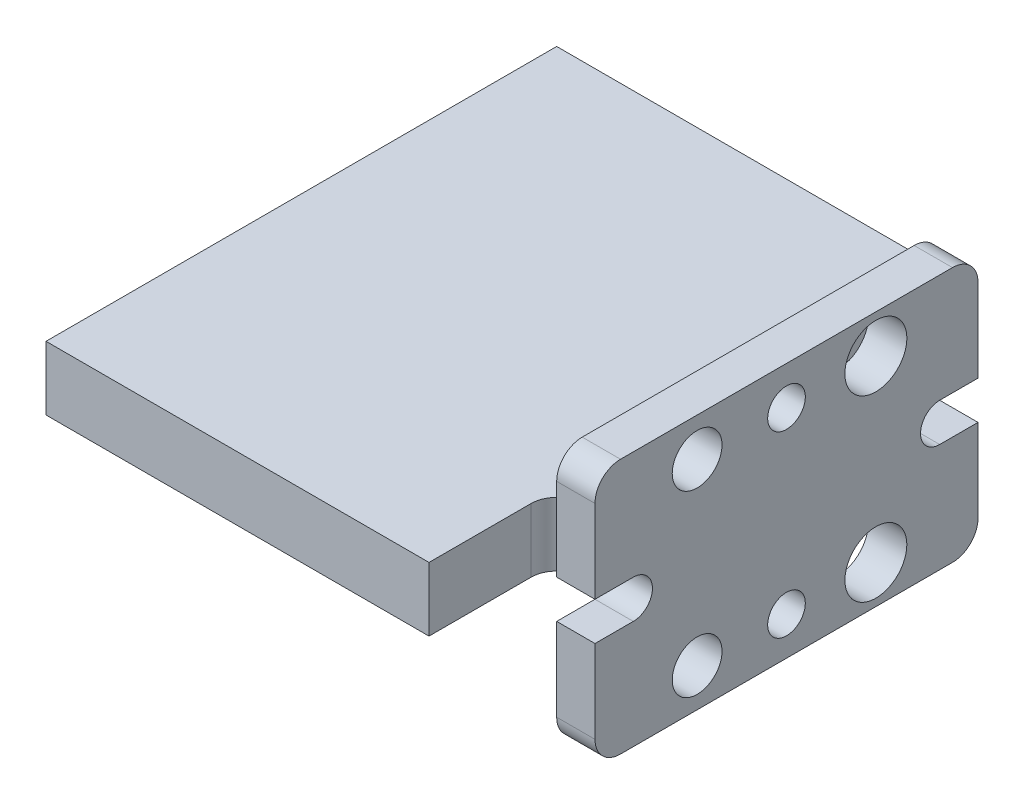
from build123d import *

# Parameters (mm, degrees)
SKETCH_1_W          = 20
SKETCH_1_H          = 5
EXTRUDE_1_DEPTH     = 35
SKETCH_2_W          = 30
SKETCH_2_H          = 20
EXTRUDE_2_DEPTH     = 3
FILLET_1_R          = 2
FILLET_2_R          = 2
FILLET_3_R          = 2
FILLET_4_R          = 2
SKETCH_4_W          = 30
SKETCH_4_H          = 40
EXTRUDE_3_DEPTH     = 2.5
FILLET_5_R          = 2
FILLET_6_R          = 2
CUT_EXTRUDE_2_DEPTH = 3
SKETCH_6_R          = 1.475
SKETCH_6_R_2        = 1.95
SKETCH_6_R_3        = 2.425
CUT_EXTRUDE_3_DEPTH = 3


with BuildPart() as part:
    # 草图1 → 凸台-拉伸1 (new body)
    with BuildSketch(Plane(origin=(0, 0, 0), x_dir=(0, 0, -1), z_dir=(1, 0, 0))):
        Rectangle(SKETCH_1_W, SKETCH_1_H)
    extrude(amount=-EXTRUDE_1_DEPTH)

    # 草图2 → 凸台-拉伸2 (add)
    with BuildSketch(Plane(origin=(0, 0, 0), x_dir=(0, 0, -1), z_dir=(1, 0, 0))):
        Rectangle(SKETCH_2_W, SKETCH_2_H)
    extrude(amount=EXTRUDE_2_DEPTH)

    # 圆角1
    fillet_1_edges = [part.edges().sort_by_distance(p)[0] for p in [
        (1.5, 10, -15),
    ]]
    fillet(fillet_1_edges, radius=FILLET_1_R)

    # 圆角2
    fillet_2_edges = [part.edges().sort_by_distance(p)[0] for p in [
        (1.5, 10, 15),
    ]]
    fillet(fillet_2_edges, radius=FILLET_2_R)

    # 圆角3
    fillet_3_edges = [part.edges().sort_by_distance(p)[0] for p in [
        (1.5, -10, -15),
    ]]
    fillet(fillet_3_edges, radius=FILLET_3_R)

    # 圆角4
    fillet_4_edges = [part.edges().sort_by_distance(p)[0] for p in [
        (1.5, -10, 15),
    ]]
    fillet(fillet_4_edges, radius=FILLET_4_R)

    # 草图4 → 凸台-拉伸3 (add, symmetric)
    with BuildSketch(Plane(origin=(0, 0, 0), x_dir=(1, 0, 0), z_dir=(0, 1, 0))):
        with Locations((-20, 0)):
            Rectangle(SKETCH_4_W, SKETCH_4_H)
    extrude(amount=EXTRUDE_3_DEPTH, both=True)

    # 圆角5
    fillet_5_edges = [part.edges().sort_by_distance(p)[0] for p in [
        (-5, 0, -10),
    ]]
    fillet(fillet_5_edges, radius=FILLET_5_R)

    # 圆角6
    fillet_6_edges = [part.edges().sort_by_distance(p)[0] for p in [
        (-5, 0, 10),
    ]]
    fillet(fillet_6_edges, radius=FILLET_6_R)

    # 草图5 → 切除-拉伸2 (cut)
    with BuildSketch(Plane(origin=(0, 0, 0), x_dir=(0, 0, -1), z_dir=(1, 0, 0))):
        with BuildLine():
            Line((-12, -1.5), (-15, -1.5))
            Line((-15, -1.5), (-15, 1.5))
            Line((-15, 1.5), (-12, 1.5))
            ThreePointArc((-12, 1.5), (-10.5, 0), (-12, -1.5))
        make_face()
        with BuildLine():
            Line((12, 1.5), (15, 1.5))
            Line((15, 1.5), (15, -1.5))
            Line((15, -1.5), (12, -1.5))
            ThreePointArc((12, -1.5), (10.5, 0), (12, 1.5))
        make_face()
    extrude(amount=CUT_EXTRUDE_2_DEPTH, mode=Mode.SUBTRACT)

    # 草图6 → 切除-拉伸3 (cut)
    with BuildSketch(Plane(origin=(0, 0, 0), x_dir=(0, 0, -1), z_dir=(1, 0, 0))):
        with Locations((0, -7)):
            Circle(SKETCH_6_R)
        with Locations((-7, -7)):
            Circle(SKETCH_6_R_2)
        with Locations((7, -7)):
            Circle(SKETCH_6_R_3)
        with Locations(Location((7, 7, 0), (0, 0, 180))):
            Circle(SKETCH_6_R_3)
        with Locations(Location((0, 7, 0), (0, 0, 180))):
            Circle(SKETCH_6_R)
        with Locations(Location((-7, 7, 0), (0, 0, 180))):
            Circle(SKETCH_6_R_2)
    extrude(amount=CUT_EXTRUDE_3_DEPTH, mode=Mode.SUBTRACT)


solid = part.part
